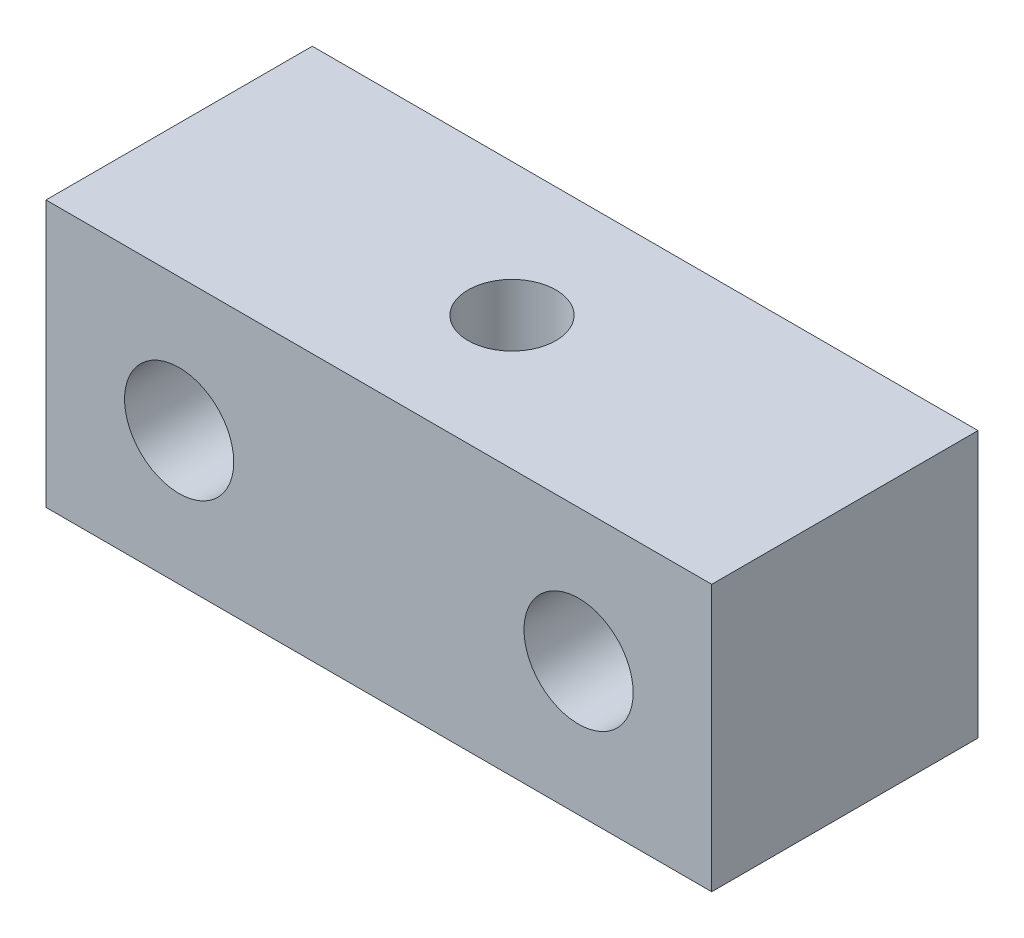
from build123d import *

# Parameters (mm, degrees)
SKETCH_1_W             = 10
SKETCH_1_H             = 10
EXTRUDE_1_DEPTH        = 25
SKETCH_2_R             = 1.5
CUT_EXTRUDE_1_DEPTH    = 28.386127875
SKETCH_3_R             = 2.05
CUT_EXTRUDE_2_DEPTH    = 28.386127875
HOLE_WIZARD_M4_2_D     = 3.3
HOLE_WIZARD_M4_2_DEPTH = 10.1
HOLE_WIZARD_M4_2_TIP   = 0.991420021


with BuildPart() as part:
    # 草图1 → 凸台-拉伸1 (new body)
    with BuildSketch(Plane(origin=(0, 0, 0), x_dir=(0, 0, -1), z_dir=(1, 0, 0))):
        Rectangle(SKETCH_1_W, SKETCH_1_H)
    extrude(amount=EXTRUDE_1_DEPTH)

    # 草图2 → 切除-拉伸1 (cut, through all)
    with BuildSketch(Plane(origin=(0, 5, 0), x_dir=(1, 0, 0), z_dir=(0, 1, 0))):
        with Locations(Location((12.5, 0, 0), (0, 0, 270))):
            Circle(SKETCH_2_R)
    extrude(amount=-CUT_EXTRUDE_1_DEPTH, mode=Mode.SUBTRACT)

    # 草图3 → 切除-拉伸2 (cut, through all)
    with BuildSketch(Plane.XY.offset(5)):
        with Locations((5, 0)):
            Circle(SKETCH_3_R)
        with Locations((20, 0)):
            Circle(SKETCH_3_R)
    extrude(amount=-CUT_EXTRUDE_2_DEPTH, mode=Mode.SUBTRACT)

    # M4 螺纹孔2
    with Locations(Plane(origin=(0, 5, 0), x_dir=(1, 0, 0), z_dir=(0, 1, 0))):
        with Locations((12.5, 0)):
            Hole(HOLE_WIZARD_M4_2_D / 2, depth=HOLE_WIZARD_M4_2_DEPTH)
            with Locations((0, 0, -(HOLE_WIZARD_M4_2_DEPTH + HOLE_WIZARD_M4_2_TIP / 2))):  # 118° drill point
                Cone(0, HOLE_WIZARD_M4_2_D / 2, HOLE_WIZARD_M4_2_TIP, mode=Mode.SUBTRACT)


solid = part.part
